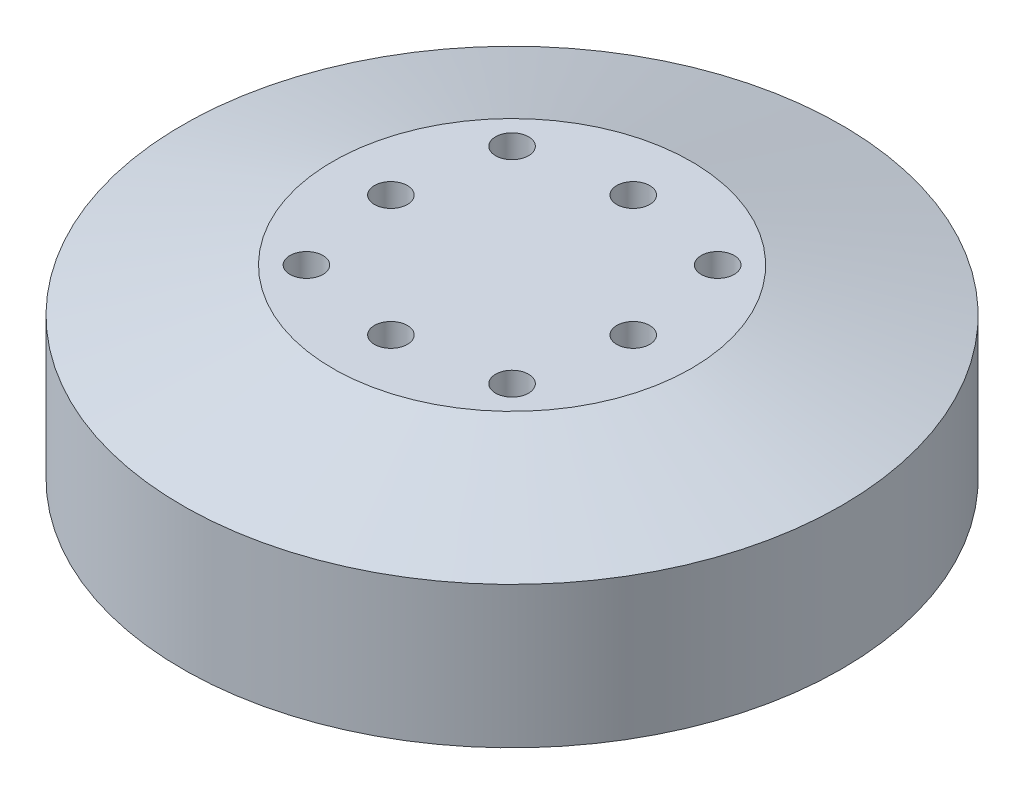
from build123d import *

# Parameters (mm, degrees)
M3_CLEARANCE_HOLE1_D     = 3.4
M3_CLEARANCE_HOLE1_DEPTH = 4
M3_CLEARANCE_HOLE1_TIP   = 1.021463052
SKETCH5_R                = 32
CUT_EXTRUDE1_DEPTH       = 1


with BuildPart() as part:
    # Sketch1 → Revolve1 (revolve)
    with BuildSketch(Plane.XY, mode=Mode.PRIVATE) as revolve1_sk:
        Polygon((0, -9.55), (0, 9.55), (-18.5, 9.55), (-34, 5.05), (-34, -9.55), align=None)
    revolve(revolve1_sk.sketch.rotate(Axis((0, -9.55, 0), (0, 1, 0)), 180), axis=Axis((0, -9.55, 0), (0, 1, 0)))

    # M3 Clearance Hole1
    with Locations(Plane(origin=(0, 9.55, 0), x_dir=(1, 0, 0), z_dir=(0, 1, 0))):
        with Locations((-10.606601718, 10.606601718), (0, 12.5), (10.606601718, 10.606601718), (12.5, 0), (10.606601718, -10.606601718), (-10.606601718, -10.606601718), (-12.5, 0), (0, -12.5)):
            Hole(M3_CLEARANCE_HOLE1_D / 2, depth=M3_CLEARANCE_HOLE1_DEPTH)
            with Locations((0, 0, -(M3_CLEARANCE_HOLE1_DEPTH + M3_CLEARANCE_HOLE1_TIP / 2))):  # 118° drill point
                Cone(0, M3_CLEARANCE_HOLE1_D / 2, M3_CLEARANCE_HOLE1_TIP, mode=Mode.SUBTRACT)

    # Sketch5 → Cut-Extrude1 (cut)
    with BuildSketch(Plane.XZ.offset(9.55)):
        Circle(SKETCH5_R)
    extrude(amount=-CUT_EXTRUDE1_DEPTH, mode=Mode.SUBTRACT)


solid = part.part
